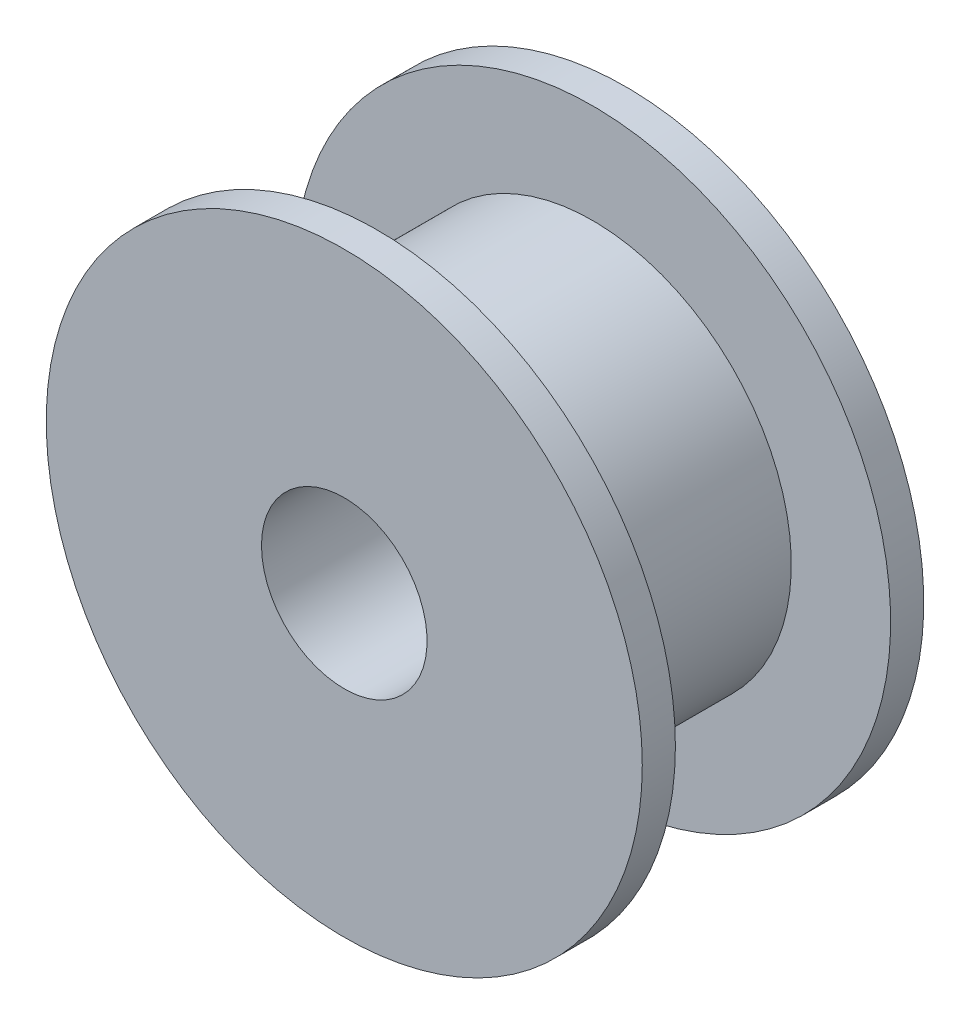
from build123d import *

# Parameters (mm, degrees)
SKETCH_1_R      = 6
SKETCH_1_R_2    = 2.5
EXTRUDE_1_DEPTH = 6.5
SKETCH_2_R      = 9
SKETCH_2_R_2    = 2.5
EXTRUDE_3_DEPTH = 1
EXTRUDE_START   = 1
SKETCH_3_R      = 9
SKETCH_3_R_2    = 2.5
EXTRUDE_4_DEPTH = 1


with BuildPart() as part:
    # 草图1 → 凸台-拉伸1 (new body)
    with BuildSketch(Plane.XY):
        with Locations(Location((0, 0, 0), (0, 0, 180))):
            Circle(SKETCH_1_R)
        with Locations(Location((0, 0, 0), (0, 0, 180))):
            Circle(SKETCH_1_R_2, mode=Mode.SUBTRACT)
    extrude(amount=EXTRUDE_1_DEPTH)

    # 草图2 → 凸台-拉伸3 (add)
    with BuildSketch(Plane.XY.offset(6.5)):
        Circle(SKETCH_2_R)
        with Locations(Location((0, 0, 0), (0, 0, 180))):
            Circle(SKETCH_2_R_2, mode=Mode.SUBTRACT)
    extrude(amount=EXTRUDE_3_DEPTH)

    # 草图3 → 凸台-拉伸4 (add)
    with BuildSketch(Plane(origin=(0, 0, 0), x_dir=(-1, 0, 0), z_dir=(0, 0, -1)).offset(EXTRUDE_START)):
        with Locations(Location((0, 0, 0), (0, 0, 180))):
            Circle(SKETCH_3_R)
        Circle(SKETCH_3_R_2, mode=Mode.SUBTRACT)
    extrude(amount=-EXTRUDE_4_DEPTH)


solid = part.part
